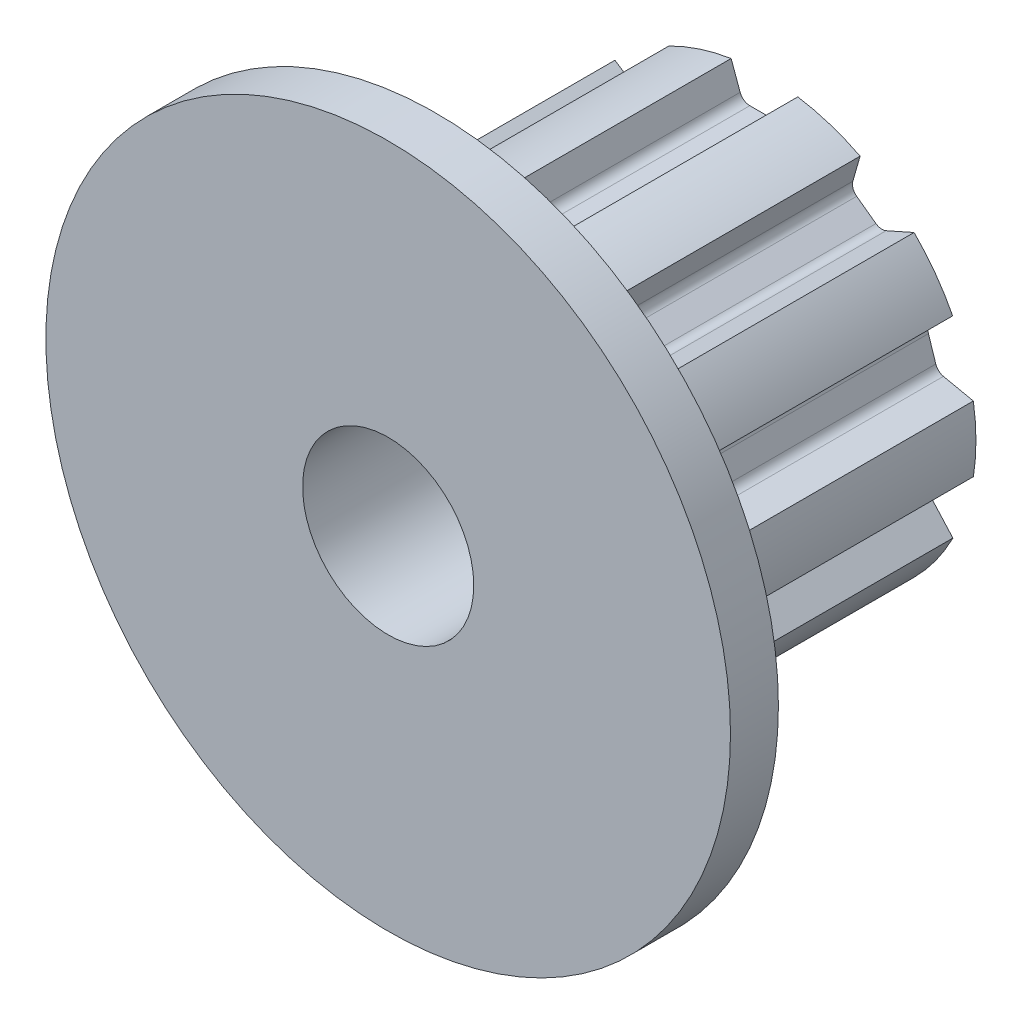
from build123d import *

# Parameters (mm, degrees)
SKETCH1_R        = 7.8359
BASEPULLEY_DEPTH = 12.192
GROOVE_DEPTH     = 6.096
GROOVES_COUNT    = 10
GROOVES_ANGLE    = 324
SKETCH4_W        = 1.778
SKETCH4_H        = 12.7
BORSKE_R         = 3.175
BORE_DEPTH       = 23.753920541


with BuildPart() as part:
    # Sketch1 → BasePulley (new body)
    with BuildSketch(Plane.XY):
        Circle(SKETCH1_R)
    extrude(amount=-BASEPULLEY_DEPTH)

    # Sketch3 → Groove (cut, symmetric)
    with BuildSketch(Plane.XY.offset(-6.096)):
        with BuildLine():
            Line((-1.2827, 7.8359), (-1.2827, 33.2359))
            Line((-1.2827, 33.2359), (1.2827, 33.2359))
            Line((1.2827, 33.2359), (1.2827, 7.8359))
            Line((1.2827, 7.8359), (0.659450384, 6.7564))
            ThreePointArc((0.659450384, 6.7564), (0.519994706, 6.616944321), (0.329494706, 6.5659))
            Line((0.329494706, 6.5659), (-0.55367873, 6.5659))
            ThreePointArc((-0.55367873, 6.5659), (-0.772211353, 6.634803071), (-0.911701619, 6.816590325))
            Line((-0.911701619, 6.816590325), (-1.2827, 7.8359))
        make_face()
    groove = extrude(amount=GROOVE_DEPTH, both=True, mode=Mode.SUBTRACT)

    # Grooves: Groove ×10 about axis
    grooves_axis = Axis((0, 0, -12.192), (0, 0, 1))
    for i in range(1, GROOVES_COUNT):
        add(groove.rotate(grooves_axis, i * GROOVES_ANGLE / (GROOVES_COUNT - 1)), mode=Mode.SUBTRACT)

    # Sketch4 → BaseHub (revolve)
    with BuildSketch(Plane(origin=(0, 0, 0), x_dir=(0, 0, -1), z_dir=(1, 0, 0)), mode=Mode.PRIVATE) as basehub_sk:
        with Locations((-0.889, 6.35)):
            Rectangle(SKETCH4_W, SKETCH4_H)
    revolve(basehub_sk.sketch.rotate(Axis((0, 0, 0), (0, 0, -1)), 90), axis=Axis((0, 0, 0), (0, 0, -1)))

    # BorSke → Bore (cut, through all)
    with BuildSketch(Plane.XY.offset(1.778)):
        Circle(BORSKE_R)
    extrude(amount=-BORE_DEPTH, mode=Mode.SUBTRACT)


solid = part.part
